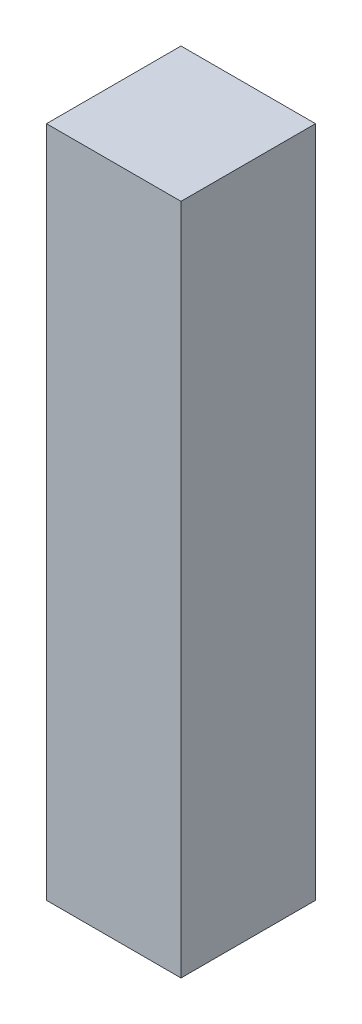
from build123d import *

# Parameters (mm, degrees)
ESQUISSE1_W        = 30
ESQUISSE1_H        = 30
BOSS_EXTRU_1_DEPTH = 150


with BuildPart() as part:
    # Esquisse1 → Boss.-Extru.1 (new body)
    with BuildSketch(Plane(origin=(0, 0, 0), x_dir=(1, 0, 0), z_dir=(0, 1, 0))):
        Rectangle(ESQUISSE1_W, ESQUISSE1_H)
    extrude(amount=BOSS_EXTRU_1_DEPTH)


solid = part.part
